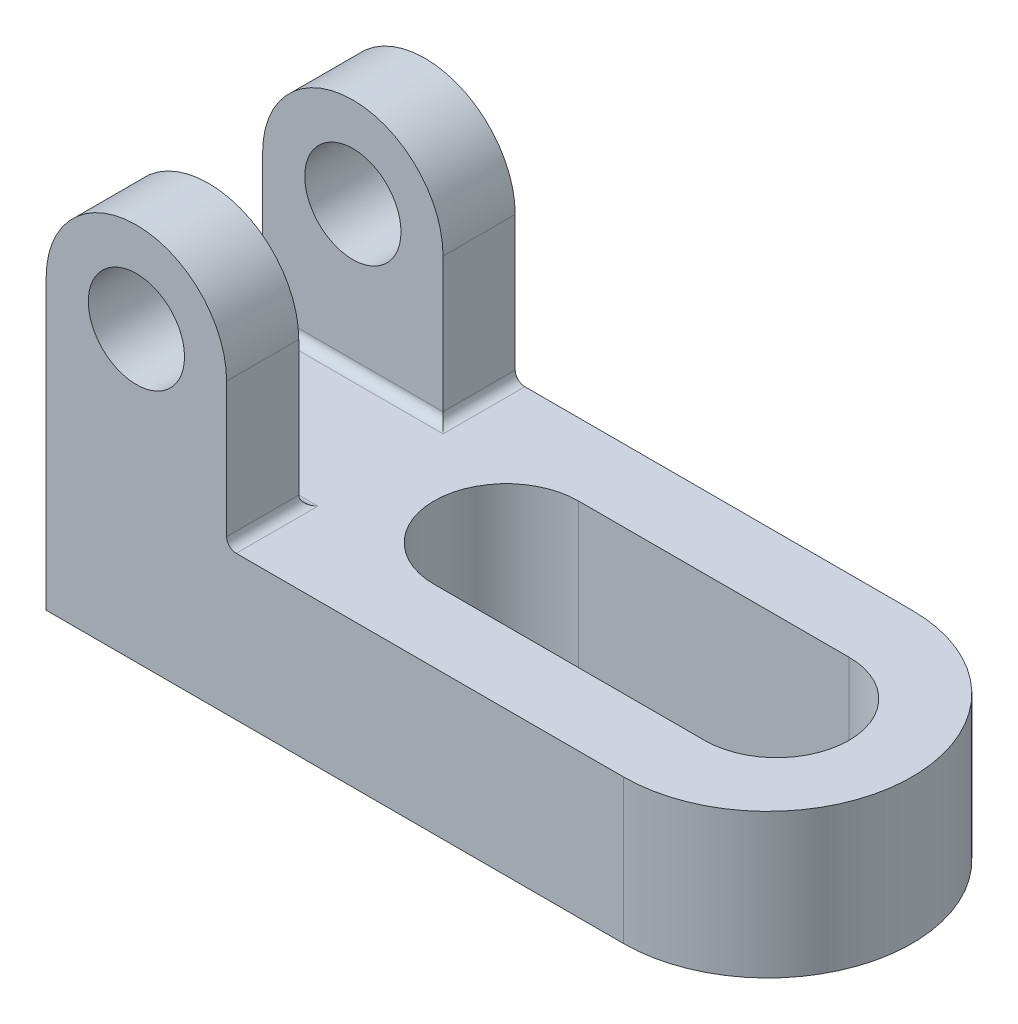
from build123d import *

# Parameters (mm, degrees)
SKETCH1_R           = 10
BOSS_EXTRUDE1_DEPTH = 60
SKETCH3_W           = 37.5
SKETCH3_H           = 30
CUT_EXTRUDE1_DEPTH  = 108.710549623
CUT_EXTRUDE2_DEPTH  = 108.710549623
FILLET1_RADIUS      = 30
FILLET1_LENGTH      = 30
FILLET2_R           = 2


with BuildPart() as part:
    # Sketch1 → Boss-Extrude1 (new body)
    with BuildSketch(Plane.XY):
        with BuildLine():
            Line((75, 0), (75, -30))
            Line((75, -30), (-75, -30))
            Line((-75, -30), (-75, 30))
            ThreePointArc((-75, 30), (-56.25, 48.75), (-37.5, 30))
            Line((-37.5, 30), (-37.5, 0))
            Line((-37.5, 0), (75, 0))
        make_face()
        with Locations((-56.25, 30)):
            Circle(SKETCH1_R, mode=Mode.SUBTRACT)
    extrude(amount=-BOSS_EXTRUDE1_DEPTH)

    # Sketch3 → Cut-Extrude1 (cut, through all)
    with BuildSketch(Plane(origin=(0, 0, 0), x_dir=(1, 0, 0), z_dir=(0, 1, 0))):
        with Locations((-56.25, 30)):
            Rectangle(SKETCH3_W, SKETCH3_H)
    extrude(amount=CUT_EXTRUDE1_DEPTH, mode=Mode.SUBTRACT)

    # Sketch3<5> → Cut-Extrude2 (cut, through all)
    with BuildSketch(Plane(origin=(0, 0, 0), x_dir=(1, 0, 0), z_dir=(0, 1, 0))):
        with BuildLine():
            Line((46.875, 45), (-9.375, 45))
            ThreePointArc((-9.375, 45), (-24.375, 30), (-9.375, 15))
            Line((-9.375, 15), (46.875, 15))
            ThreePointArc((46.875, 15), (61.875, 30), (46.875, 45))
        make_face()
    extrude(amount=-CUT_EXTRUDE2_DEPTH, mode=Mode.SUBTRACT)

    # Fillet1: full round fillet: the end face becomes a half cylinder, R = half its width
    fillet1_face = Plane((75, -15, -30), x_dir=(0, 1, 0), z_dir=(1, 0, 0))  # on the end face: x along it, z out of the body
    fillet1_slab = fillet1_face.offset(-FILLET1_RADIUS / 2) * Box(FILLET1_LENGTH, 2 * FILLET1_RADIUS, FILLET1_RADIUS, mode=Mode.PRIVATE)  # the body's end, R deep
    fillet1_round = Plane((45, -15, -30), x_dir=(1, 0, 0), z_dir=(0, 1, 0)) * Cylinder(FILLET1_RADIUS, FILLET1_LENGTH, mode=Mode.PRIVATE)  # its axis R under the face
    add(fillet1_slab - fillet1_round, mode=Mode.SUBTRACT)

    # Fillet2
    fillet2_edges = [part.edges().sort_by_distance(p)[0] for p in [
        (-37.5, 0, -52.5),
        (-37.5, 0, -7.5),
        (-56.25, 0, -45),
        (-56.25, 0, -15),
    ]]
    fillet(fillet2_edges, radius=FILLET2_R)


solid = part.part
